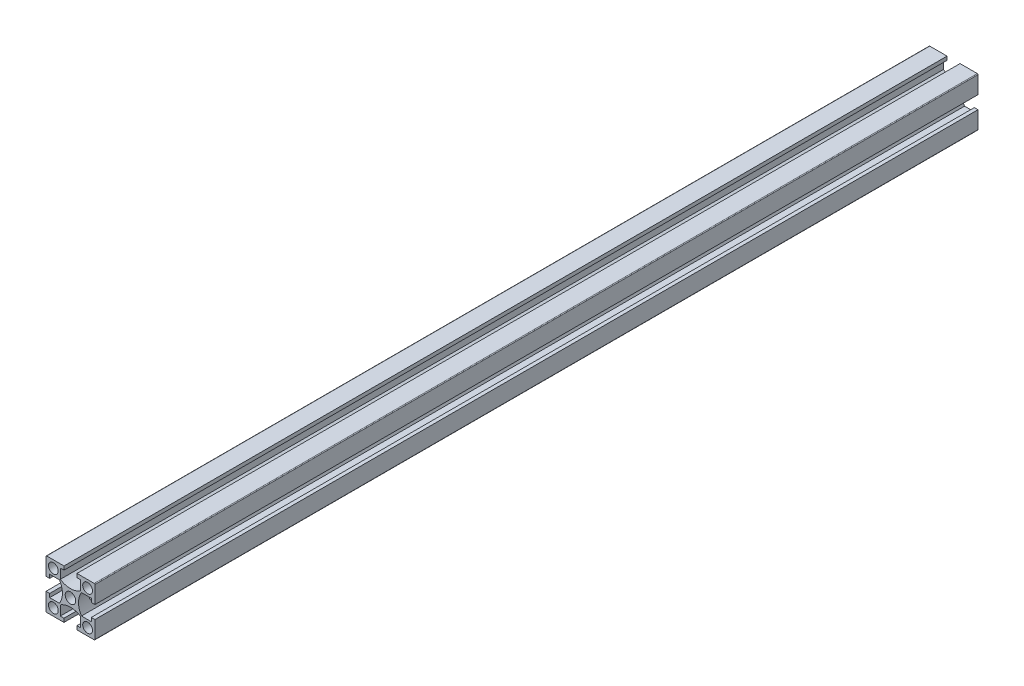
from build123d import *

# Parameters (mm, degrees)
SKETCH_1_W               = 20
SKETCH_1_H               = 20
SKETCH_1_R               = 2
SKETCH_1_R_2             = 2.15
EXTRUDE_1_DEPTH          = 361
CUT_EXTRUDE_1_REACH      = 363.277
PATTERN_CIRCULAR_1_COUNT = 4
FILLET_1_R               = 0.3
SKETCH_4_R               = 2.15
CUT_EXTRUDE_3_DEPTH      = 362.691857802
SKETCH_6_R               = 2.5
CUT_EXTRUDE_4_DEPTH      = 362.691857901


with BuildPart() as part:
    # 스케치1 → 보스-돌출1 (new body)
    with BuildSketch(Plane.XY):
        Rectangle(SKETCH_1_W, SKETCH_1_H)
        with Locations((-7, -7)):
            Circle(SKETCH_1_R, mode=Mode.SUBTRACT)
        with Locations((7, -7)):
            Circle(SKETCH_1_R, mode=Mode.SUBTRACT)
        with Locations((-7, 7)):
            Circle(SKETCH_1_R, mode=Mode.SUBTRACT)
        Circle(SKETCH_1_R_2, mode=Mode.SUBTRACT)
        with Locations((7, 7)):
            Circle(SKETCH_1_R, mode=Mode.SUBTRACT)
    extrude(amount=EXTRUDE_1_DEPTH)

    # 스케치1<3> → 컷-돌출1 (cut, up to next)
    with BuildSketch(Plane.XY, mode=Mode.PRIVATE) as cut_extrude_1_sk1:
        with BuildLine():
            Line((-8.5, 2.65), (-10, 2.65))
            Line((-10, 2.65), (-10, -2.65))
            Line((-10, -2.65), (-8.5, -2.65))
            Line((-8.5, -2.65), (-8.5, -4.15))
            Line((-8.5, -4.15), (-4.503166667, -4.15))
            ThreePointArc((-4.503166667, -4.15), (-3.3, 0), (-4.503166667, 4.15))
            Line((-4.503166667, 4.15), (-8.5, 4.15))
            Line((-8.5, 4.15), (-8.5, 2.65))
        make_face()
    cut_extrude_1_tool1 = extrude(cut_extrude_1_sk1.sketch, amount=CUT_EXTRUDE_1_REACH, mode=Mode.PRIVATE) & part.part
    cut_extrude_1 = cut_extrude_1_tool1.solids().sort_by_distance((-6.606913, 0, 0))[0]
    add(cut_extrude_1, mode=Mode.SUBTRACT)

    # 원형 패턴1: 컷-돌출1 ×4 about axis
    pattern_circular_1_axis = Axis((0, 0, 361), (0, 0, -1))
    for i in range(1, PATTERN_CIRCULAR_1_COUNT):
        add(cut_extrude_1.rotate(pattern_circular_1_axis, i * 360 / PATTERN_CIRCULAR_1_COUNT), mode=Mode.SUBTRACT)

    # 필렛1
    fillet_1_edges = [part.edges().sort_by_distance(p)[0] for p in [
        (10, -10, 180.5),
        (-10, -10, 180.5),
        (-10, 10, 180.5),
        (10, 10, 180.5),
    ]]
    fillet(fillet_1_edges, radius=FILLET_1_R)

    # 스케치4 → 컷-돌출3 (cut, through all)
    with BuildSketch(Plane(origin=(0, 10, 0), x_dir=(1, 0, 0), z_dir=(0, 1, 0))):
        with Locations((0, -56)):
            Circle(SKETCH_4_R)
        with Locations((0, -108)):
            Circle(SKETCH_4_R)
        with Locations((0, -351)):
            Circle(SKETCH_4_R)
        with Locations((0, -271)):
            Circle(SKETCH_4_R)
    extrude(amount=-CUT_EXTRUDE_3_DEPTH, mode=Mode.SUBTRACT)

    # 스케치6 → 컷-돌출4 (cut, through all)
    with BuildSketch(Plane.ZY.offset(10)):
        with Locations((287.765981284, 0.234018716)):
            Circle(SKETCH_6_R)
        with Locations((354.234018716, 0.234018716)):
            Circle(SKETCH_6_R)
    extrude(amount=-CUT_EXTRUDE_4_DEPTH, mode=Mode.SUBTRACT)


solid = part.part
